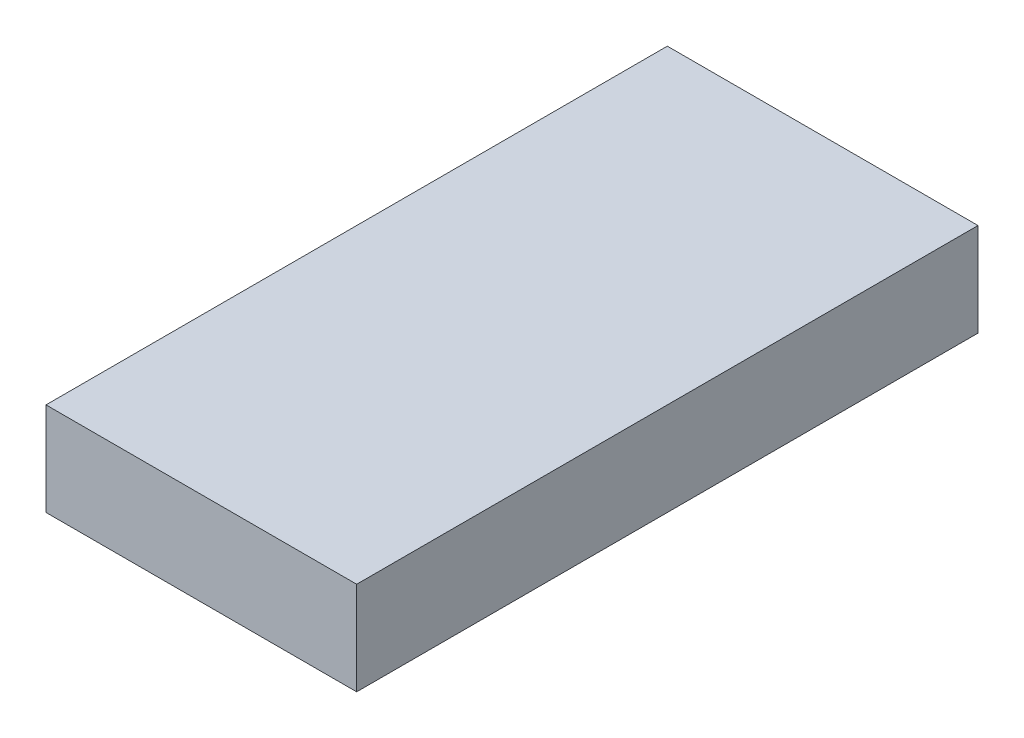
from build123d import *

# Parameters (mm, degrees)
SKETCH1_W           = 5
SKETCH1_H           = 10
BOSS_EXTRUDE1_DEPTH = 1.5


with BuildPart() as part:
    # Sketch1 → Boss-Extrude1 (new body)
    with BuildSketch(Plane(origin=(0, 0, 0), x_dir=(1, 0, 0), z_dir=(0, 1, 0))):
        with Locations((-2.5, 5)):
            Rectangle(SKETCH1_W, SKETCH1_H)
    extrude(amount=BOSS_EXTRUDE1_DEPTH)


solid = part.part
